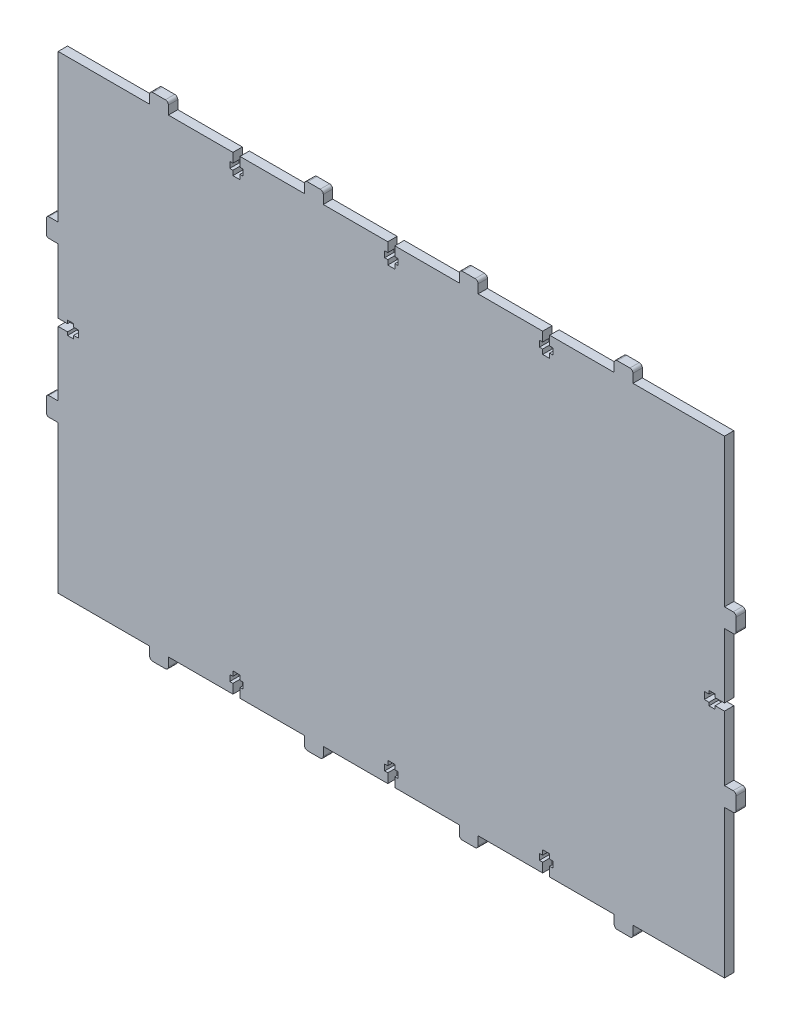
from build123d import *

# Parameters (mm, degrees)
EXTRUDE_1_DEPTH = 4
FILLET_1_R      = 1
FILLET_2_R      = 1.3


with BuildPart() as part:
    # 草图1 → 凸台-拉伸1 (new body)
    with BuildSketch(Plane.XY):
        Polygon((0, 0), (0, -4), (-1.35, -4), (-1.35, -6.6), (0, -6.6), (0, -8.6), (3, -8.6), (3, -6.6), (4.35, -6.6), (4.35, -4), (3, -4), (3, 0), (30.5, 0), (30.5, 5), (38.5, 5), (38.5, 0), (66, 0), (66, -4), (64.65, -4), (64.65, -6.6), (66, -6.6), (66, -8.6), (69, -8.6), (69, -6.6), (70.35, -6.6), (70.35, -4), (69, -4), (69, 0), (96.5, 0), (96.5, 5), (104.5, 5), (104.5, 0), (132, 0), (143.5, 0), (143.5, -63), (148.5, -63), (148.5, -71), (143.5, -71), (143.5, -98.5), (139.5, -98.5), (139.5, -97.15), (136.9, -97.15), (136.9, -98.5), (134.9, -98.5), (134.9, -101.5), (136.9, -101.5), (136.9, -102.85), (139.5, -102.85), (139.5, -101.5), (143.5, -101.5), (143.5, -129), (148.5, -129), (148.5, -137), (143.5, -137), (143.5, -200), (132, -200), (104.5, -200), (104.5, -205), (96.5, -205), (96.5, -200), (69, -200), (69, -196), (70.35, -196), (70.35, -193.4), (69, -193.4), (69, -191.4), (66, -191.4), (66, -193.4), (64.65, -193.4), (64.65, -196), (66, -196), (66, -200), (38.5, -200), (38.5, -205), (30.5, -205), (30.5, -200), (3, -200), (3, -196), (4.35, -196), (4.35, -193.4), (3, -193.4), (3, -191.4), (0, -191.4), (0, -193.4), (-1.35, -193.4), (-1.35, -196), (0, -196), (0, -200), (-27.5, -200), (-27.5, -205), (-35.5, -205), (-35.5, -200), (-63, -200), (-63, -196), (-61.65, -196), (-61.65, -193.4), (-63, -193.4), (-63, -191.4), (-66, -191.4), (-66, -193.4), (-67.35, -193.4), (-67.35, -196), (-66, -196), (-66, -200), (-93.5, -200), (-93.5, -205), (-101.5, -205), (-101.5, -200), (-129, -200), (-140.5, -200), (-140.5, -137), (-145.5, -137), (-145.5, -129), (-140.5, -129), (-140.5, -101.5), (-136.5, -101.5), (-136.5, -102.85), (-133.9, -102.85), (-133.9, -101.5), (-131.9, -101.5), (-131.9, -98.5), (-133.9, -98.5), (-133.9, -97.15), (-136.5, -97.15), (-136.5, -98.5), (-140.5, -98.5), (-140.5, -71), (-145.5, -71), (-145.5, -63), (-140.5, -63), (-140.5, 0), (-129, 0), (-101.5, 0), (-101.5, 5), (-93.5, 5), (-93.5, 0), (-66, 0), (-66, -4), (-67.35, -4), (-67.35, -6.6), (-66, -6.6), (-66, -8.6), (-63, -8.6), (-63, -6.6), (-61.65, -6.6), (-61.65, -4), (-63, -4), (-63, 0), (-35.5, 0), (-35.5, 5), (-27.5, 5), (-27.5, 0), align=None)
    extrude(amount=EXTRUDE_1_DEPTH)

    # 圆角1
    fillet_1_edges = [part.edges().sort_by_distance(p)[0] for p in [
        (-145.5, -63, 2),
        (-145.5, -71, 2),
        (-145.5, -129, 2),
        (-145.5, -137, 2),
    ]]
    fillet(fillet_1_edges, radius=FILLET_1_R)

    # 圆角2
    fillet_2_edges = [part.edges().sort_by_distance(p)[0] for p in [
        (38.5, 5, 2),
        (30.5, 5, 2),
        (-27.5, 5, 2),
        (-35.5, 5, 2),
        (-93.5, 5, 2),
        (-101.5, 5, 2),
        (-101.5, -205, 2),
        (-93.5, -205, 2),
        (-35.5, -205, 2),
        (-27.5, -205, 2),
        (30.5, -205, 2),
        (38.5, -205, 2),
        (96.5, -205, 2),
        (104.5, -205, 2),
        (148.5, -137, 2),
        (148.5, -129, 2),
        (148.5, -71, 2),
        (148.5, -63, 2),
        (104.5, 5, 2),
        (96.5, 5, 2),
    ]]
    fillet(fillet_2_edges, radius=FILLET_2_R)


solid = part.part
